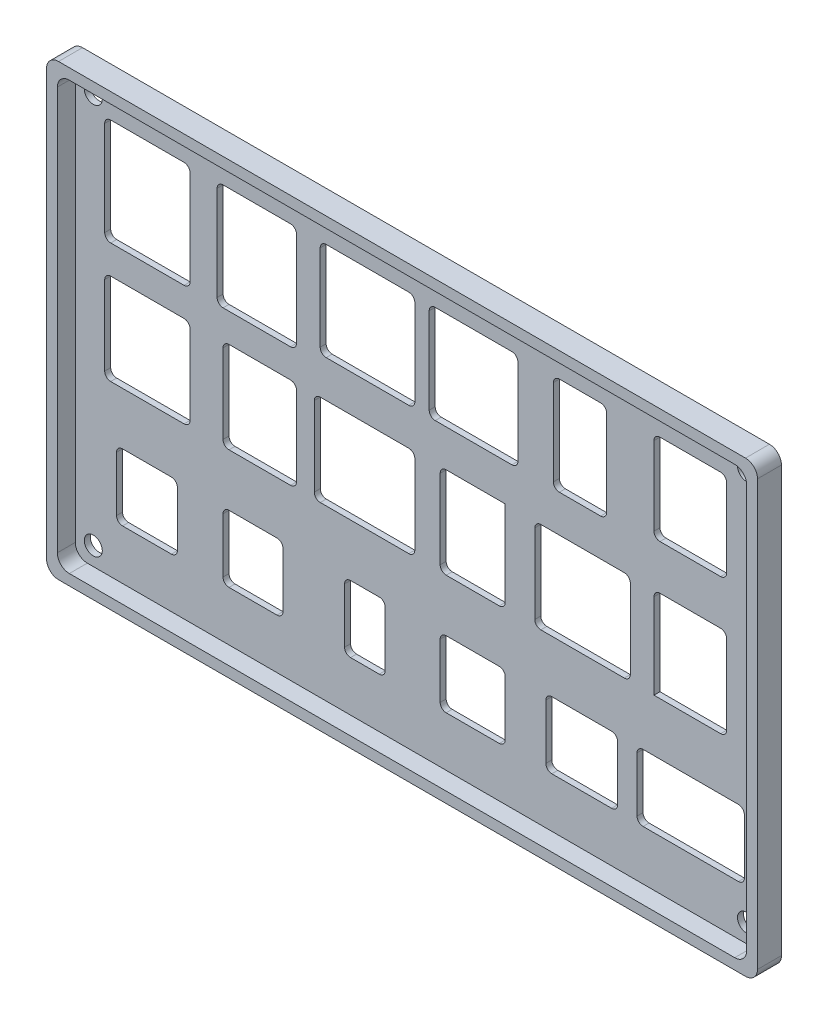
from build123d import *

# Parameters (mm, degrees)
SKETCH1_W           = 115.032318381
SKETCH1_H           = 71.30067782
SKETCH1_R           = 1.5
SKETCH1_W_2         = 14.242069011
SKETCH1_H_2         = 17.767333618
SKETCH1_W_3         = 13.254994921
SKETCH1_W_4         = 15.793185438
SKETCH1_H_3         = 16.357227775
SKETCH1_W_5         = 14.806111349
SKETCH1_W_6         = 8.883666809
SKETCH1_W_7         = 12.126910247
SKETCH1_H_4         = 15.088132517
SKETCH1_H_5         = 15.229143101
SKETCH1_W_8         = 12.267920831
SKETCH1_W_9         = 16.780259528
SKETCH1_W_10        = 10.857814989
SKETCH1_W_11        = 15.934196022
SKETCH1_W_12        = 10.152762067
SKETCH1_H_6         = 11.139836158
SKETCH1_W_13        = 10.011751483
SKETCH1_W_14        = 6.79124771
SKETCH1_W_15        = 11.985899662
SKETCH1_W_16        = 17.908344202
BOSS_EXTRUDE1_DEPTH = 1
FILLET1_R           = 2
SKETCH2_W           = 118.632318381
SKETCH2_H           = 74.90067782
SKETCH2_W_2         = 115.032318381
SKETCH2_H_2         = 71.30067782
EXTRUDE_THIN1_DEPTH = 4
FILLET2_R           = 2
FILLET6_R           = 1


with BuildPart() as part:
    # Sketch1 → Boss-Extrude1 (new body)
    with BuildSketch(Plane.XY):
        with Locations((12.588840856, -6.753997536)):
            Rectangle(SKETCH1_W, SKETCH1_H)
        with Locations((-41.927318334, 25.896341374)):
            Circle(SKETCH1_R, mode=Mode.SUBTRACT)
        with Locations((67.072681666, 25.896341374)):
            Circle(SKETCH1_R, mode=Mode.SUBTRACT)
        with Locations((67.072681666, -39.353658626)):
            Circle(SKETCH1_R, mode=Mode.SUBTRACT)
        with Locations((-41.927318334, -39.353658626)):
            Circle(SKETCH1_R, mode=Mode.SUBTRACT)
        with Locations((-32.903231762, 14.704950183)):
            Rectangle(SKETCH1_W_2, SKETCH1_H_2, mode=Mode.SUBTRACT)
        with Locations((-14.642361099, 14.704950183)):
            Rectangle(SKETCH1_W_3, SKETCH1_H_2, mode=Mode.SUBTRACT)
        with Locations((3.830025441, 15.410003105)):
            Rectangle(SKETCH1_W_4, SKETCH1_H_3, mode=Mode.SUBTRACT)
        with Locations((21.526853767, 15.410003105)):
            Rectangle(SKETCH1_W_5, SKETCH1_H_3, mode=Mode.SUBTRACT)
        with Locations((39.294187385, 15.410003105)):
            Rectangle(SKETCH1_W_6, SKETCH1_H_3, mode=Mode.SUBTRACT)
        with Locations((57.696068632, 16.044550734)):
            Rectangle(SKETCH1_W_7, SKETCH1_H_4, mode=Mode.SUBTRACT)
        with Locations((-32.903231762, -6.587648042)):
            Rectangle(SKETCH1_W_2, SKETCH1_H_5, mode=Mode.SUBTRACT)
        with Locations((-14.148824054, -6.587648042)):
            Rectangle(SKETCH1_W_8, SKETCH1_H_5, mode=Mode.SUBTRACT)
        with Locations((3.336488396, -6.587648042)):
            Rectangle(SKETCH1_W_9, SKETCH1_H_5, mode=Mode.SUBTRACT)
        with Locations((21.385843183, -6.587648042)):
            Rectangle(SKETCH1_W_10, SKETCH1_H_5, mode=Mode.SUBTRACT)
        with Locations((39.717219137, -6.587648042)):
            Rectangle(SKETCH1_W_11, SKETCH1_H_5, mode=Mode.SUBTRACT)
        with Locations((57.696068632, -6.587648042)):
            Rectangle(SKETCH1_W_7, SKETCH1_H_5, mode=Mode.SUBTRACT)
        with Locations((-32.973737054, -28.514793895)):
            Rectangle(SKETCH1_W_12, SKETCH1_H_6, mode=Mode.SUBTRACT)
        with Locations((-15.276908728, -28.514793895)):
            Rectangle(SKETCH1_W_13, SKETCH1_H_6, mode=Mode.SUBTRACT)
        with Locations((3.395623855, -28.514793895)):
            Rectangle(SKETCH1_W_14, SKETCH1_H_6, mode=Mode.SUBTRACT)
        with Locations((21.385843183, -28.514793895)):
            Rectangle(SKETCH1_W_10, SKETCH1_H_6, mode=Mode.SUBTRACT)
        with Locations((39.576208553, -28.514793895)):
            Rectangle(SKETCH1_W_15, SKETCH1_H_6, mode=Mode.SUBTRACT)
        with Locations((57.766573924, -28.514793895)):
            Rectangle(SKETCH1_W_16, SKETCH1_H_6, mode=Mode.SUBTRACT)
    extrude(amount=BOSS_EXTRUDE1_DEPTH)

    # Fillet1
    fillet1_edges = [part.edges().sort_by_distance(p)[0] for p in [
        (-44.927318334, 28.896341374, 0.5),
        (70.105000047, 28.896341374, 0.5),
        (70.105000047, -42.404336446, 0.5),
        (-44.927318334, -42.404336446, 0.5),
    ]]
    fillet(fillet1_edges, radius=FILLET1_R)

    # Fillet6
    fillet6_edges = [part.edges().sort_by_distance(p)[0] for p in [
        (-20.282784469, 1.026923509, 0.5),
        (-20.282784469, -14.202219592, 0.5),
        (-8.014863638, -14.202219592, 0.5),
        (-8.014863638, 1.026923509, 0.5),
        (-5.053641368, 1.026923509, 0.5),
        (-5.053641368, -14.202219592, 0.5),
        (11.72661816, -14.202219592, 0.5),
        (11.72661816, 1.026923509, 0.5),
        (15.956935688, 1.026923509, 0.5),
        (15.956935688, -14.202219592, 0.5),
        (26.814750677, -14.202219592, 0.5),
        (31.750121126, 1.026923509, 0.5),
        (31.750121126, -14.202219592, 0.5),
        (47.684317148, -14.202219592, 0.5),
        (47.684317148, 1.026923509, 0.5),
        (-40.024266267, 23.588616992, 0.5),
        (51.632613508, 1.026923509, 0.5),
        (63.759523755, -14.202219592, 0.5),
        (63.759523755, 1.026923509, 0.5),
        (-40.024266267, 5.821283374, 0.5),
        (-25.782197256, 5.821283374, 0.5),
        (-25.782197256, 23.588616992, 0.5),
        (-38.050118087, -22.944875816, 0.5),
        (-38.050118087, -34.084711974, 0.5),
        (-27.89735602, -34.084711974, 0.5),
        (-27.89735602, -22.944875816, 0.5),
        (-20.282784469, -22.944875816, 0.5),
        (-20.282784469, -34.084711974, 0.5),
        (-10.271032986, -34.084711974, 0.5),
        (-10.271032986, -22.944875816, 0.5),
        (0, -22.944875816, 0.5),
        (0, -34.084711974, 0.5),
        (6.79124771, -34.084711974, 0.5),
        (6.79124771, -22.944875816, 0.5),
        (15.956935688, -22.944875816, 0.5),
        (15.956935688, -34.084711974, 0.5),
        (26.814750677, -34.084711974, 0.5),
        (26.814750677, -22.944875816, 0.5),
        (33.583258722, -22.944875816, 0.5),
        (33.583258722, -34.084711974, 0.5),
        (45.569158384, -34.084711974, 0.5),
        (45.569158384, -22.944875816, 0.5),
        (48.812401823, -22.944875816, 0.5),
        (48.812401823, -34.084711974, 0.5),
        (66.720746025, -34.084711974, 0.5),
        (66.720746025, -22.944875816, 0.5),
        (-21.269858559, 23.588616992, 0.5),
        (-21.269858559, 5.821283374, 0.5),
        (-8.014863638, 5.821283374, 0.5),
        (-8.014863638, 23.588616992, 0.5),
        (-4.066567278, 23.588616992, 0.5),
        (-4.066567278, 7.231389217, 0.5),
        (11.72661816, 7.231389217, 0.5),
        (11.72661816, 23.588616992, 0.5),
        (14.123798092, 23.588616992, 0.5),
        (14.123798092, 7.231389217, 0.5),
        (28.929909441, 7.231389217, 0.5),
        (28.929909441, 23.588616992, 0.5),
        (34.85235398, 23.588616992, 0.5),
        (34.85235398, 7.231389217, 0.5),
        (43.736020789, 7.231389217, 0.5),
        (43.736020789, 23.588616992, 0.5),
        (51.632613508, 23.588616992, 0.5),
        (51.632613508, 8.500484475, 0.5),
        (63.759523755, 8.500484475, 0.5),
        (63.759523755, 23.588616992, 0.5),
        (-40.024266267, 1.026923509, 0.5),
        (-40.024266267, -14.202219592, 0.5),
        (-25.782197256, -14.202219592, 0.5),
        (-25.782197256, 1.026923509, 0.5),
    ]]
    fillet(fillet6_edges, radius=FILLET6_R)


with BuildPart() as body_2:
    # Sketch2 → Extrude-Thin1 (new body)
    with BuildSketch(Plane(origin=(0, 0, 0), x_dir=(-1, 0, 0), z_dir=(0, 0, -1))):
        with Locations((-12.588840856, -6.753997536)):
            Rectangle(SKETCH2_W, SKETCH2_H)
        with Locations((-12.588840856, -6.753997536)):
            Rectangle(SKETCH2_W_2, SKETCH2_H_2, mode=Mode.SUBTRACT)
    extrude(amount=-EXTRUDE_THIN1_DEPTH)

    # Fillet2
    fillet2_edges = [body_2.edges().sort_by_distance(p)[0] for p in [
        (70.105000047, -42.404336446, 2),
        (70.105000047, 28.896341374, 2),
        (-44.927318334, 28.896341374, 2),
        (-44.927318334, -42.404336446, 2),
        (71.905000047, 30.696341374, 2),
        (-46.727318334, 30.696341374, 2),
        (-46.727318334, -44.204336446, 2),
        (71.905000047, -44.204336446, 2),
    ]]
    fillet(fillet2_edges, radius=FILLET2_R)


solid = Compound([part.part, body_2.part])
